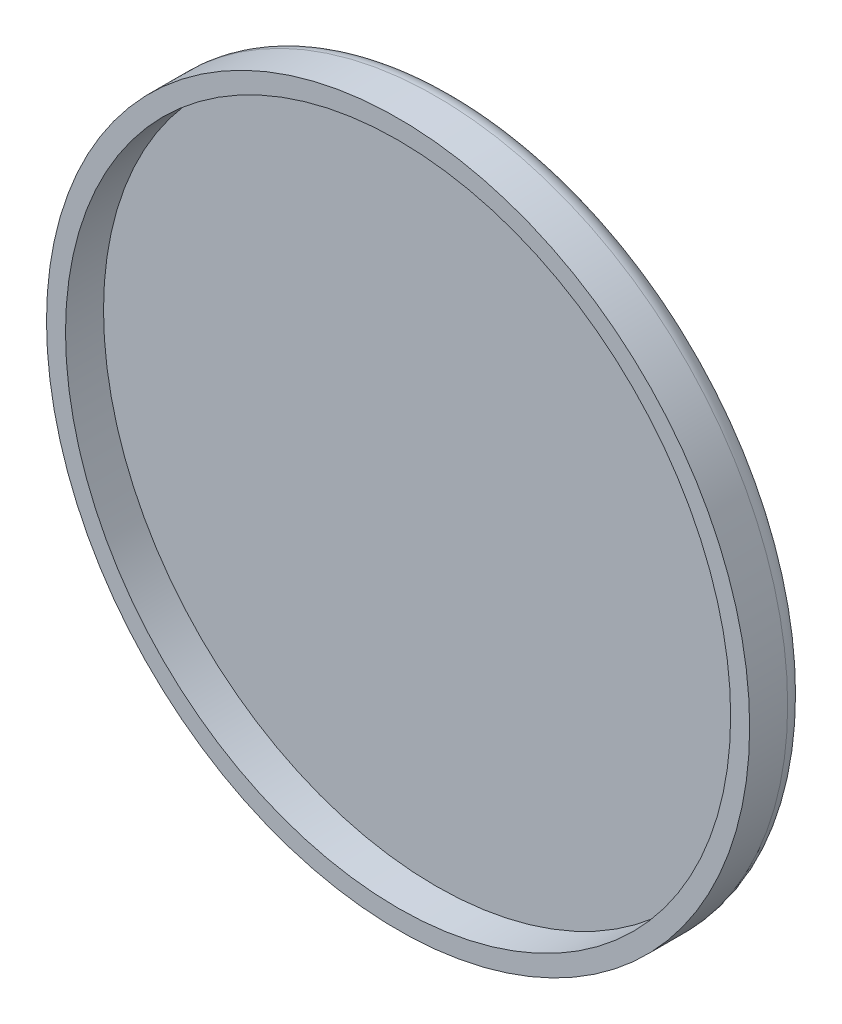
from build123d import *

# Parameters (mm, degrees)
ESQUISSE1_R             = 37
BOSS_EXTRU_1_DEPTH      = 6
ESQUISSE2_R             = 35
ENL_V_MAT_EXTRU_1_DEPTH = 4
CONG_1_R                = 2


with BuildPart() as part:
    # Esquisse1 → Boss.-Extru.1 (new body)
    with BuildSketch(Plane.XY):
        Circle(ESQUISSE1_R)
    extrude(amount=BOSS_EXTRU_1_DEPTH)

    # Esquisse2 → Enlèv. mat.-Extru.1 (cut)
    with BuildSketch(Plane.XY.offset(6)):
        Circle(ESQUISSE2_R)
    extrude(amount=-ENL_V_MAT_EXTRU_1_DEPTH, mode=Mode.SUBTRACT)

    # Congé1
    cong_1_edges = [part.edges().sort_by_distance(p)[0] for p in [
        (-37, 0, 0),
    ]]
    fillet(cong_1_edges, radius=CONG_1_R)


solid = part.part
